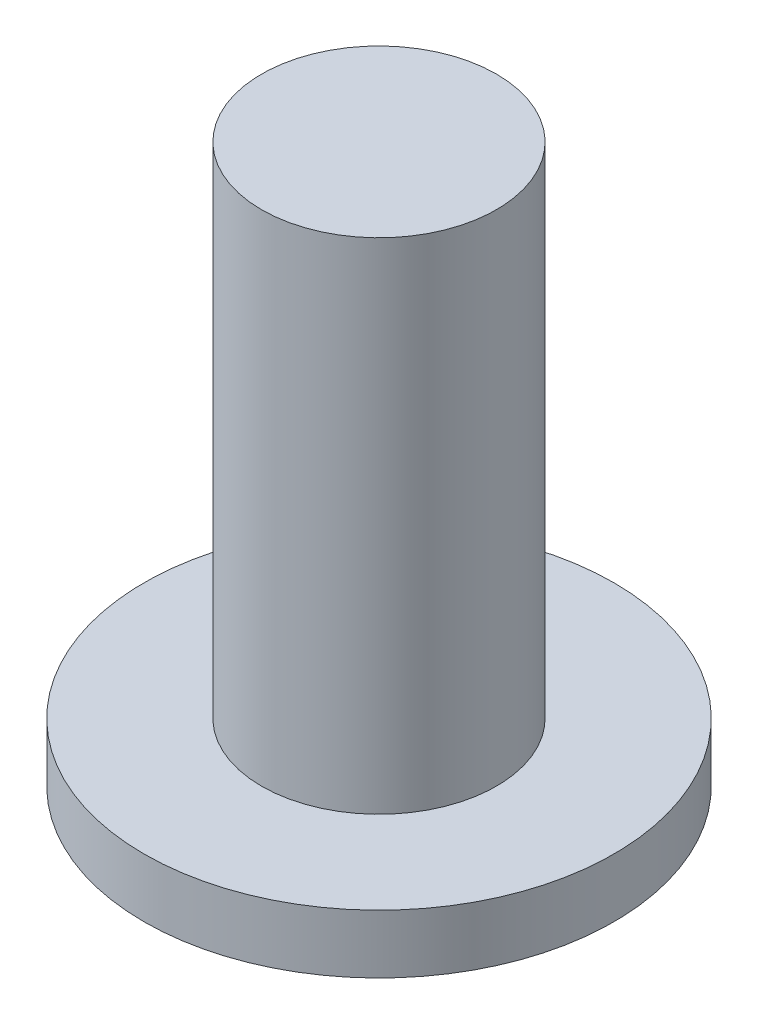
from build123d import *


with BuildPart() as part:
    # Sketch2 → Revolve1 (revolve)
    with BuildSketch(Plane(origin=(0, 0, 0), x_dir=(0, 0, -1), z_dir=(1, 0, 0))):
        Polygon((-100, 225), (0, 225), (0, -250), (-200, -250), (-200, -200), (-100, -200), align=None)
    revolve(axis=Axis((0, 293.92033543, 0), (0, -1, 0)))


solid = part.part
